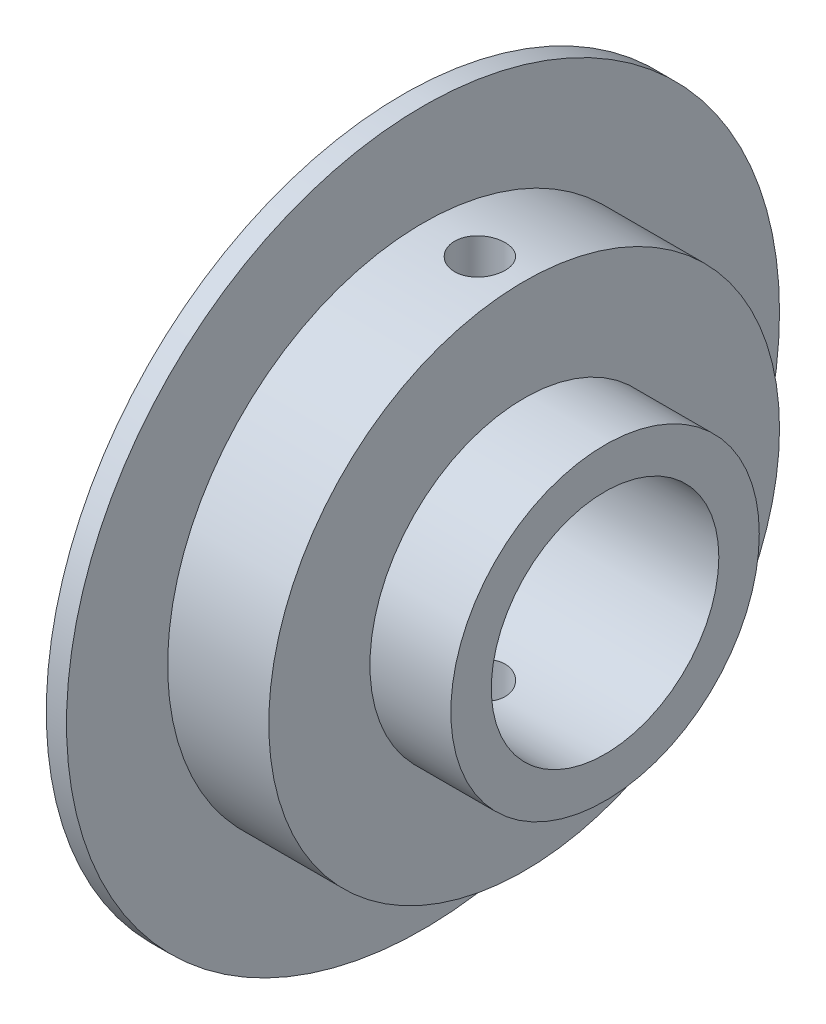
from build123d import *

# Parameters (mm, degrees)
CUT_EXTRUDE1_DEPTH      = 22.485343842
CUT_EXTRUDE1_DEPTH_BACK = 22.485343842
SKETCH4_R               = 1


with BuildPart() as part:
    # Sketch1 → Revolve1 (revolve)
    with BuildSketch(Plane.XY, mode=Mode.PRIVATE) as revolve1_sk:
        Polygon((0, 0), (8, 0), (8, 1.6), (4.8, 1.6), (4.8, 5.6), (0.8, 5.6), (0.8, 9.6), (0, 9.6), align=None)
    revolve(revolve1_sk.sketch.rotate(Axis((124.631559107, -4.5, 0), (-1, 0, 0)), 90), axis=Axis((124.631559107, -4.5, 0), (-1, 0, 0)))

    # Sketch4 → Cut-Extrude1 (cut, two sides: drawn at the far end of the back side and taken through both)
    with BuildSketch(Plane(origin=(0, -4.5, 0), x_dir=(1, 0, 0), z_dir=(0, 1, 0)).offset(-CUT_EXTRUDE1_DEPTH_BACK)):
        with Locations(Location((3.05, 0, 0), (0, 0, 270))):
            Circle(SKETCH4_R)
    extrude(amount=CUT_EXTRUDE1_DEPTH + CUT_EXTRUDE1_DEPTH_BACK, mode=Mode.SUBTRACT)


solid = part.part
